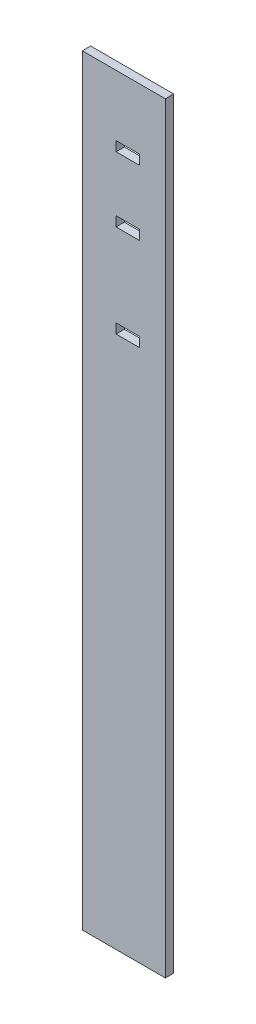
from build123d import *

# Parameters (mm, degrees)
SKETCH1_W           = 275
SKETCH1_H           = 30
BOSS_EXTRUDE1_DEPTH = 3
SKETCH2_W           = 8.5
SKETCH2_H           = 3.5
CUT_EXTRUDE1_DEPTH  = 139.348292364


with BuildPart() as part:
    # Sketch1 → Boss-Extrude1 (new body)
    with BuildSketch(Plane(origin=(0, 0, 0), x_dir=(0, 1, 0), z_dir=(0, 0, 1))):
        Rectangle(SKETCH1_W, SKETCH1_H)
    extrude(amount=BOSS_EXTRUDE1_DEPTH)

    # Sketch2 → Cut-Extrude1 (cut, through all)
    with BuildSketch(Plane(origin=(0, 0, 0), x_dir=(1, 0, 0), z_dir=(0, 0, -1))):
        with Locations((1.440759591, -90.25)):
            Rectangle(SKETCH2_W, SKETCH2_H)
        with Locations((1.440759591, -113.75)):
            Rectangle(SKETCH2_W, SKETCH2_H)
        with Locations((1.440759591, -56.75)):
            Rectangle(SKETCH2_W, SKETCH2_H)
    extrude(amount=-CUT_EXTRUDE1_DEPTH, mode=Mode.SUBTRACT)


solid = part.part
